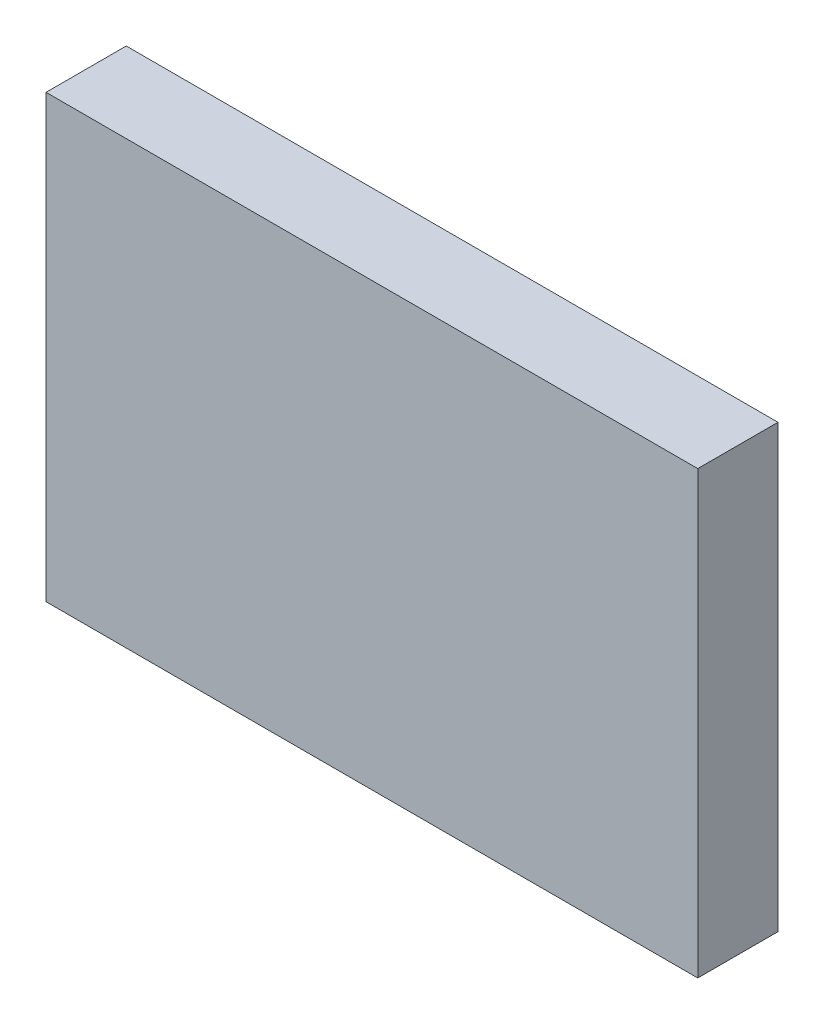
from build123d import *

# Parameters (mm, degrees)
SKETCH1_W           = 65
SKETCH1_H           = 44
BOSS_EXTRUDE1_DEPTH = 8


with BuildPart() as part:
    # Sketch1 → Boss-Extrude1 (new body)
    with BuildSketch(Plane.XY):
        with Locations((32.5, 22)):
            Rectangle(SKETCH1_W, SKETCH1_H)
    extrude(amount=BOSS_EXTRUDE1_DEPTH)


solid = part.part
